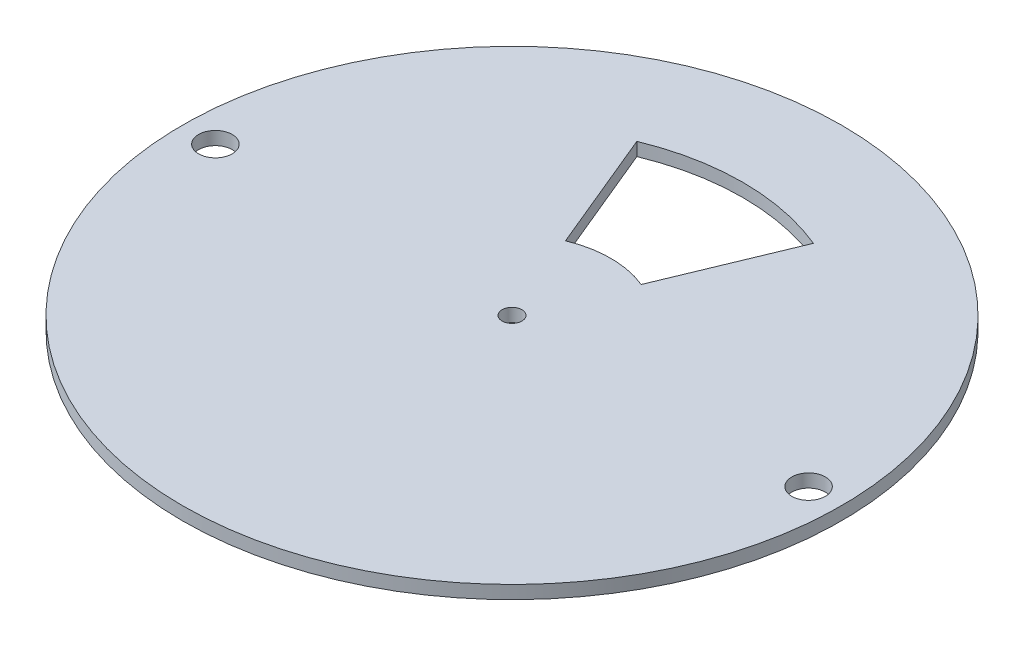
from build123d import *

# Parameters (mm, degrees)
SKETCH2_R           = 50
BOSS_EXTRUDE1_DEPTH = 2
CUT_EXTRUDE1_REACH  = 72.739
SKETCH4_R           = 2.55
CUT_EXTRUDE2_DEPTH  = 71.738956735
CIRPATTERN1_COUNT   = 2
SKETCH5_R           = 1.5
CUT_EXTRUDE3_DEPTH  = 71.738956735


with BuildPart() as part:
    # Sketch2 → Boss-Extrude1 (new body)
    with BuildSketch(Plane(origin=(0, 0, 0), x_dir=(1, 0, 0), z_dir=(0, 1, 0))):
        with Locations(Location((0, 0, 0), (0, 0, 270))):
            Circle(SKETCH2_R)
    extrude(amount=BOSS_EXTRUDE1_DEPTH)

    # Sketch3 → Cut-Extrude1 (cut, up to next)
    with BuildSketch(Plane(origin=(0, 2, 0), x_dir=(1, 0, 0), z_dir=(0, 1, 0)), mode=Mode.PRIVATE) as cut_extrude1_sk1:
        with BuildLine():
            Line((-5.740251485, 13.858192988), (-13.393920133, 32.335783638))
            ThreePointArc((-13.393920133, 32.335783638), (0, 35), (13.393920133, 32.335783638))
            Line((13.393920133, 32.335783638), (5.740251485, 13.858192988))
            ThreePointArc((5.740251485, 13.858192988), (0, 15), (-5.740251485, 13.858192988))
        make_face()
    cut_extrude1_tool1 = extrude(cut_extrude1_sk1.sketch, amount=-CUT_EXTRUDE1_REACH, mode=Mode.PRIVATE) & part.part
    add(cut_extrude1_tool1.solids().sort_by_distance((0, 2, -25.661711))[0], mode=Mode.SUBTRACT)

    # Sketch4 → Cut-Extrude2 (cut, through all)
    with BuildSketch(Plane(origin=(0, 2, 0), x_dir=(1, 0, 0), z_dir=(0, 1, 0))):
        with Locations(Location((45, 0, 0), (0, 0, 270))):
            Circle(SKETCH4_R)
    cut_extrude2 = extrude(amount=-CUT_EXTRUDE2_DEPTH, mode=Mode.SUBTRACT)

    # CirPattern1: Cut-Extrude2 ×2 about axis
    cirpattern1_axis = Axis((0, 0, 0), (0, 1, 0))
    for i in range(1, CIRPATTERN1_COUNT):
        add(cut_extrude2.rotate(cirpattern1_axis, i * 360 / CIRPATTERN1_COUNT), mode=Mode.SUBTRACT)

    # Sketch5 → Cut-Extrude3 (cut, through all)
    with BuildSketch(Plane(origin=(0, 2, 0), x_dir=(1, 0, 0), z_dir=(0, 1, 0))):
        with Locations(Location((0, 0, 0), (0, 0, 270))):
            Circle(SKETCH5_R)
    extrude(amount=-CUT_EXTRUDE3_DEPTH, mode=Mode.SUBTRACT)


solid = part.part
